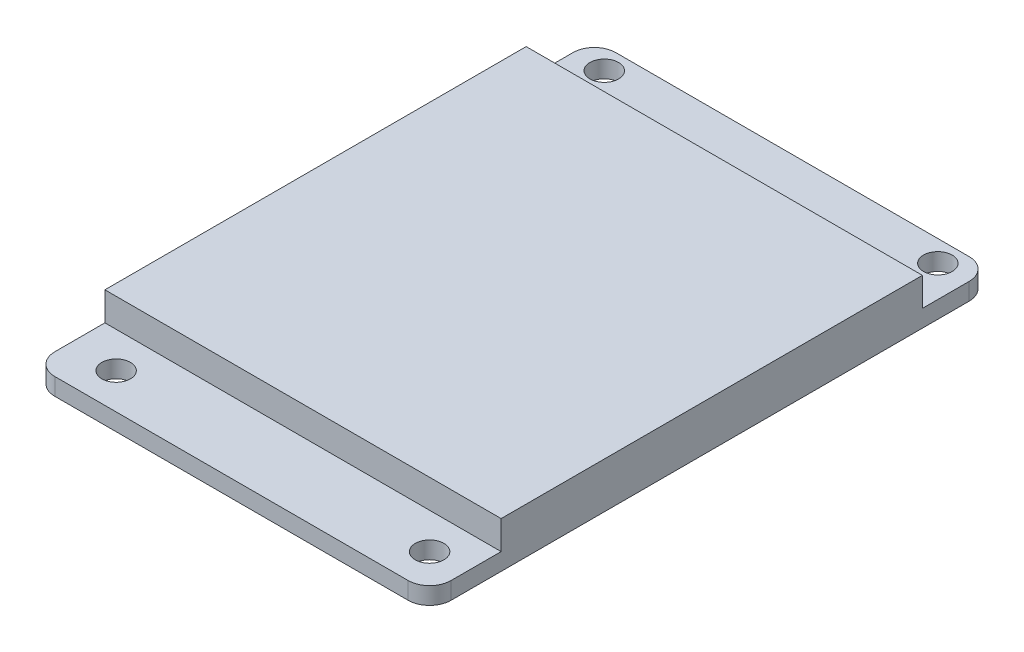
from build123d import *

# Parameters (mm, degrees)
SKETCH1_R           = 1
BOSS_EXTRUDE1_DEPTH = 1.2
SKETCH2_W           = 27.7
SKETCH2_H           = 29.450740724
BOSS_EXTRUDE2_DEPTH = 2


with BuildPart() as part:
    # Sketch1 → Boss-Extrude1 (new body)
    with BuildSketch(Plane(origin=(0, 0, 0), x_dir=(1, 0, 0), z_dir=(0, 1, 0))):
        with BuildLine():
            ThreePointArc((0, 37.72), (0.439339828, 38.780660172), (1.5, 39.22))
            Line((1.5, 39.22), (26.2, 39.22))
            ThreePointArc((26.2, 39.22), (27.260660172, 38.780660172), (27.7, 37.72))
            Line((27.7, 37.72), (27.7, 1.5))
            ThreePointArc((27.7, 1.5), (27.260660172, 0.439339828), (26.2, 0))
            Line((26.2, 0), (1.5, 0))
            ThreePointArc((1.5, 0), (0.439339828, 0.439339828), (0, 1.5))
            Line((0, 1.5), (0, 37.72))
        make_face()
        with Locations(Location((25.2, 2.5, 0), (0, 0, 270))):
            Circle(SKETCH1_R, mode=Mode.SUBTRACT)
        with Locations(Location((3.286079962, 2.5, 0), (0, 0, 270))):
            Circle(SKETCH1_R, mode=Mode.SUBTRACT)
        with Locations(Location((25.51, 37.72, 0), (0, 0, 270))):
            Circle(SKETCH1_R, mode=Mode.SUBTRACT)
        with Locations(Location((2.19, 37.72, 0), (0, 0, 270))):
            Circle(SKETCH1_R, mode=Mode.SUBTRACT)
    extrude(amount=BOSS_EXTRUDE1_DEPTH)

    # Sketch2 → Boss-Extrude2 (add)
    with BuildSketch(Plane(origin=(0, 1.2, 0), x_dir=(1, 0, 0), z_dir=(0, 1, 0))):
        with Locations((13.85, 19.725370362)):
            Rectangle(SKETCH2_W, SKETCH2_H)
    extrude(amount=BOSS_EXTRUDE2_DEPTH)


solid = part.part
